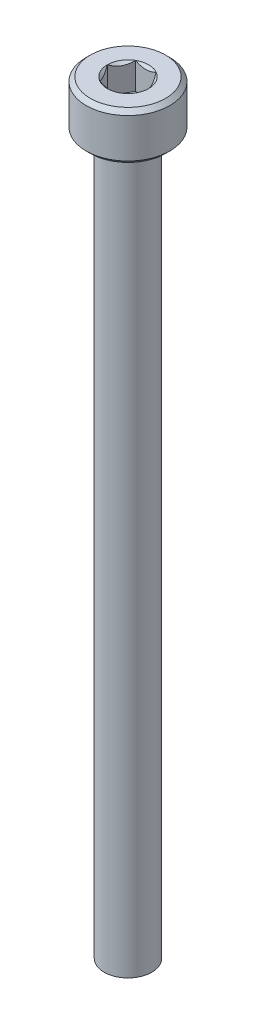
from build123d import *

# Parameters (mm, degrees)
SKETCH1_R           = 3.5
BOSS_EXTRUDE1_DEPTH = 4
CUT_EXTRUDE1_DEPTH  = 2.25
CHAMFER1_SIZE       = 0.35
SKETCH_1_R          = 2
EXTRUDE_1_DEPTH     = 60


with BuildPart() as part:
    # Sketch1 → Boss-Extrude1 (new body)
    with BuildSketch(Plane(origin=(0, 0, 0), x_dir=(1, 0, 0), z_dir=(0, 1, 0))):
        with Locations(Location((0, 0, 0), (0, 0, 270))):
            Circle(SKETCH1_R)
    extrude(amount=BOSS_EXTRUDE1_DEPTH)

    # Sketch2 → Cut-Extrude1 (cut)
    with BuildSketch(Plane(origin=(0, 4, 0), x_dir=(1, 0, 0), z_dir=(0, 1, 0))):
        Polygon((0.866025404, 1.5), (-0.866025404, 1.5), (-1.732050808, 0), (-0.866025404, -1.5), (0.866025404, -1.5), (1.732050808, 0), align=None)
    extrude(amount=-CUT_EXTRUDE1_DEPTH, mode=Mode.SUBTRACT)

    # Cut-Extrude2 cone 1 section (through the dimple's axis) → Cut-Extrude2 (revolve, cut)
    with BuildSketch(Plane(origin=(0, 4, 0), x_dir=(0, 0, 1), z_dir=(1, 0, 0))):
        Polygon((0, 0), (1.732050808, 0), (0, 1.732050808), align=None)
    revolve(axis=Axis((0, 4, 0), (0, -1, 0)), mode=Mode.SUBTRACT)

    # Chamfer1
    chamfer1_edges = [part.edges().sort_by_distance(p)[0] for p in [
        (0, 0, -3.5),
        (0, 4, -3.5),
    ]]
    chamfer(chamfer1_edges, length=CHAMFER1_SIZE)

    # 草图1 → 凸台-拉伸1 (add)
    with BuildSketch(Plane(origin=(0, 0, 0), x_dir=(-1, 0, 0), z_dir=(0, -1, 0))):
        with Locations(Location((0, 0, 0), (0, 0, 90))):
            Circle(SKETCH_1_R)
    extrude(amount=EXTRUDE_1_DEPTH)


solid = part.part
